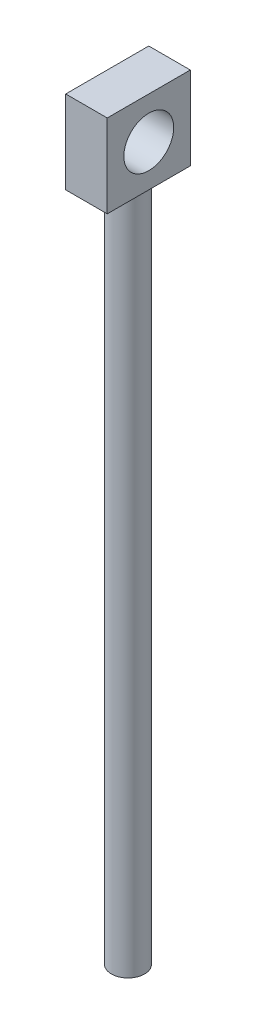
from build123d import *

# Parameters (mm, degrees)
SKETCH_1_R       = 2
EXTRUDE_1_DEPTH  = 60
SKETCH_8_W       = 10
SKETCH_8_H       = 10
SKETCH_8_R       = 3
EXTRUDE_8_DEPTH  = 2.5
EXTRUDE_START    = 5
SKETCH_9_R       = 2
EXTRUDE_9_DEPTH  = 5
SKETCH_12_R      = 2
EXTRUDE_11_DEPTH = 5
EXTRUDE_START_2  = 7
SKETCH_10_R      = 2
EXTRUDE_10_DEPTH = 12


with BuildPart() as part:
    # 草图1 → 凸台-拉伸1 (new body)
    with BuildSketch(Plane(origin=(0, 0, 0), x_dir=(1, 0, 0), z_dir=(0, 1, 0))):
        Circle(SKETCH_1_R)
    extrude(amount=EXTRUDE_1_DEPTH)

    # 草图8 → 凸台-拉伸8 (add, symmetric)
    with BuildSketch(Plane(origin=(0, 0, 0), x_dir=(0, 0, -1), z_dir=(1, 0, 0))):
        with Locations((0, 65)):
            Rectangle(SKETCH_8_W, SKETCH_8_H)
        with Locations((0, 65)):
            Circle(SKETCH_8_R, mode=Mode.SUBTRACT)
    extrude(amount=EXTRUDE_8_DEPTH, both=True)

    # 草图9 → 凸台-拉伸9 (add)
    with BuildSketch(Plane.XZ.offset(EXTRUDE_START)):
        Circle(SKETCH_9_R)
    extrude(amount=-EXTRUDE_9_DEPTH)

    # 草图12 → 凸台-拉伸11 (add)
    with BuildSketch(Plane.XZ.offset(5).offset(EXTRUDE_START)):
        Circle(SKETCH_12_R)
    extrude(amount=-EXTRUDE_11_DEPTH)

    # 草图10 → 凸台-拉伸10 (add)
    with BuildSketch(Plane.XZ.offset(15).offset(EXTRUDE_START_2)):
        Circle(SKETCH_10_R)
    extrude(amount=-EXTRUDE_10_DEPTH)


solid = part.part
